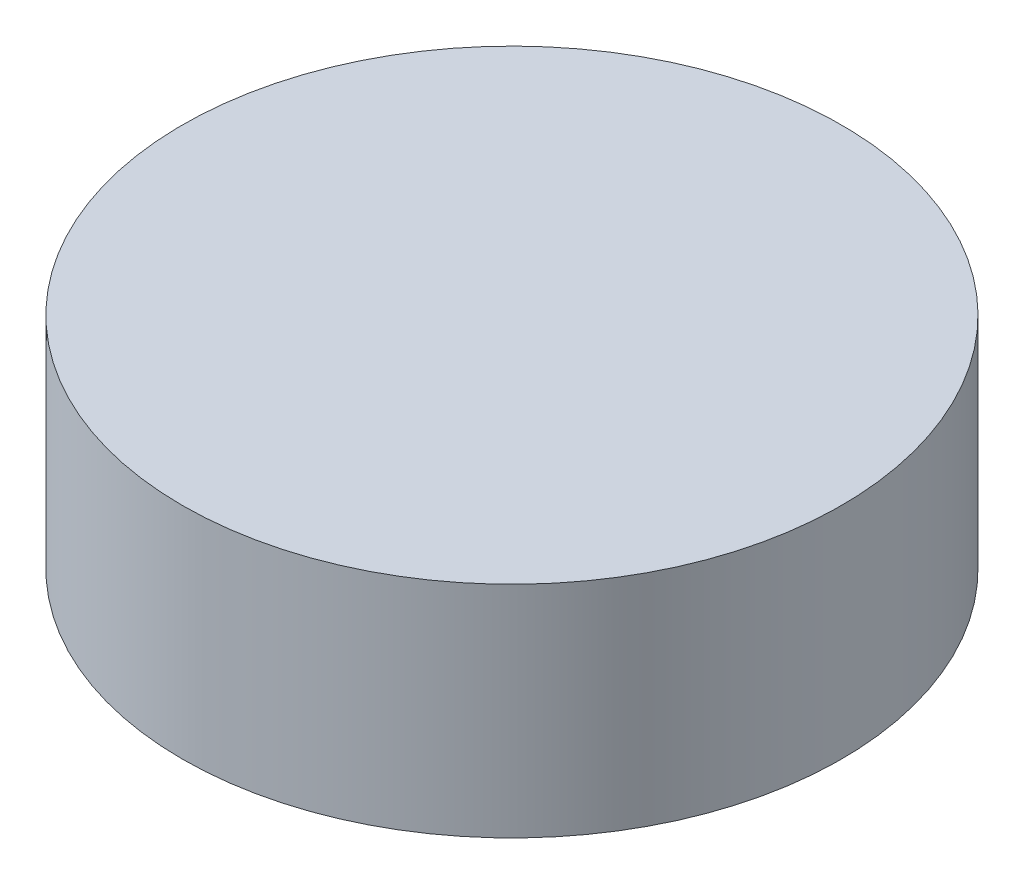
from build123d import *

# Parameters (mm, degrees)
SKETCH1_R           = 1.5
BOSS_EXTRUDE1_DEPTH = 1


with BuildPart() as part:
    # Sketch1 → Boss-Extrude1 (new body)
    with BuildSketch(Plane(origin=(0, 0, 0), x_dir=(1, 0, 0), z_dir=(0, 1, 0))):
        with Locations(Location((0, 0, 0), (0, 0, 270))):
            Circle(SKETCH1_R)
    extrude(amount=BOSS_EXTRUDE1_DEPTH)


solid = part.part
